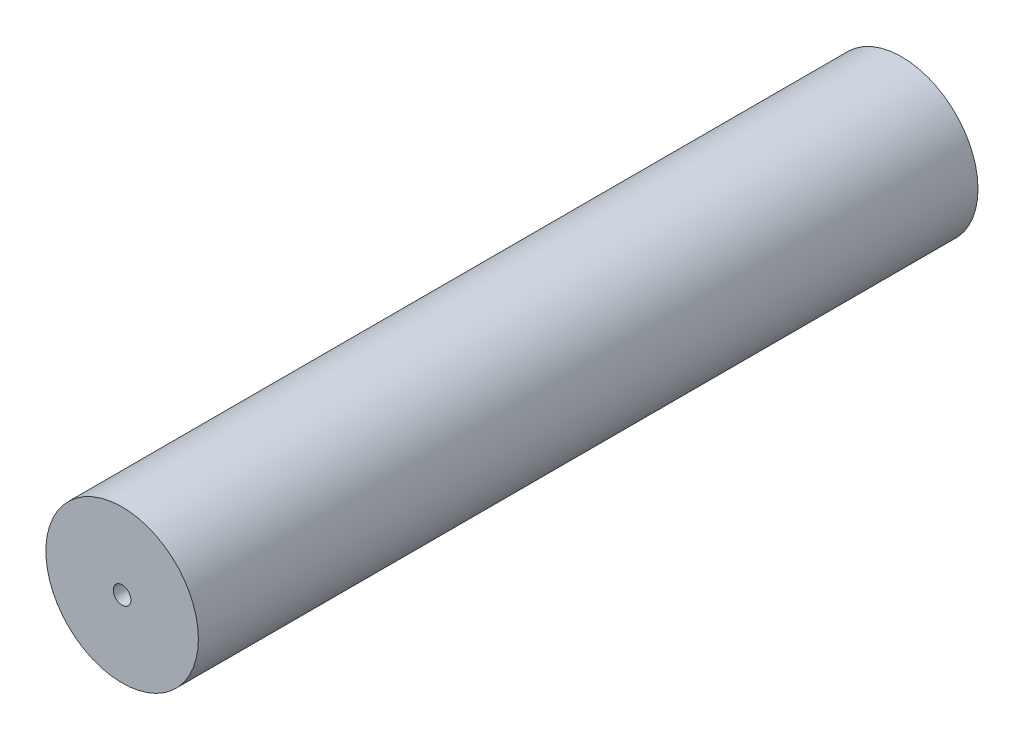
from build123d import *

# Parameters (mm, degrees)
SKETCH2_R           = 28.575
SKETCH2_R_2         = 3.302
BOSS_EXTRUDE1_DEPTH = 292.1


with BuildPart() as part:
    # Sketch2 → Boss-Extrude1 (new body)
    with BuildSketch(Plane.XY):
        Circle(SKETCH2_R)
        Circle(SKETCH2_R_2, mode=Mode.SUBTRACT)
    extrude(amount=BOSS_EXTRUDE1_DEPTH)


solid = part.part
